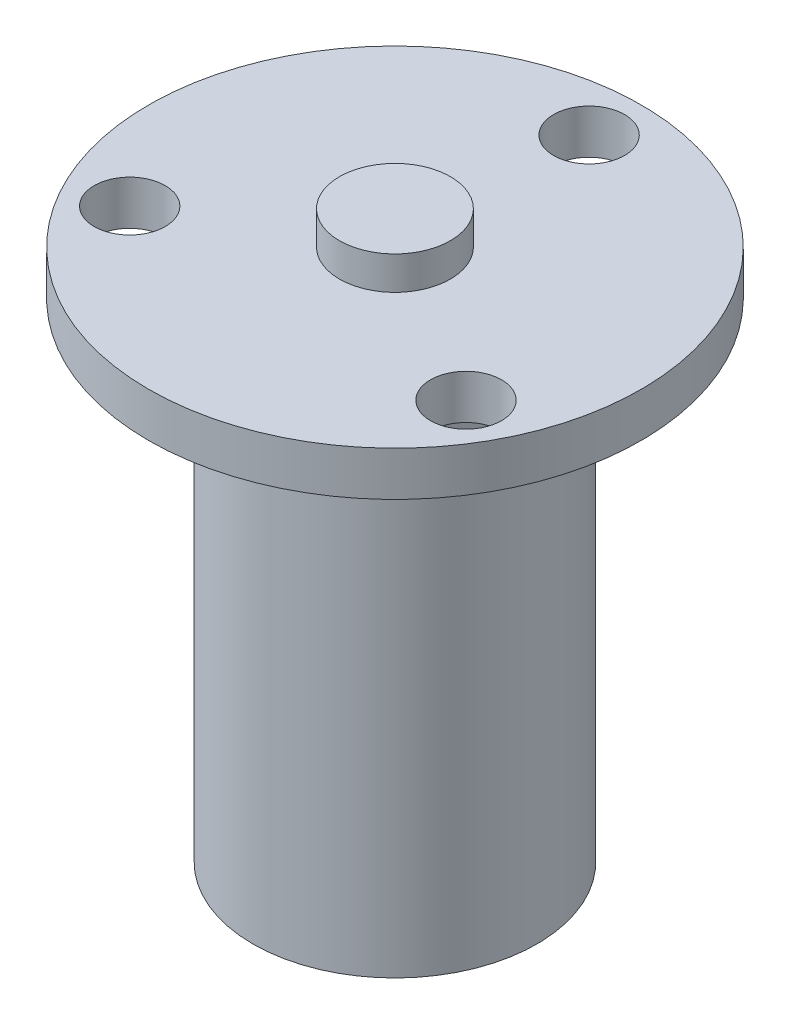
from build123d import *

# Parameters (mm, degrees)
SKETCH_1_R      = 6.4
EXTRUDE_1_DEPTH = 22
SKETCH_2_R      = 11.1
SKETCH_2_R_2    = 1.6
EXTRUDE_3_DEPTH = 2
SKETCH_3_R      = 2.5
EXTRUDE_4_DEPTH = 1.5


with BuildPart() as part:
    # 草图1 → 凸台-拉伸1 (new body)
    with BuildSketch(Plane(origin=(0, 0, 0), x_dir=(1, 0, 0), z_dir=(0, 1, 0))):
        with Locations(Location((0, 0, 0), (0, 0, 270))):
            Circle(SKETCH_1_R)
    extrude(amount=EXTRUDE_1_DEPTH)

    # 草图2 → 凸台-拉伸3 (add)
    with BuildSketch(Plane(origin=(0, 22, 0), x_dir=(1, 0, 0), z_dir=(0, 1, 0))):
        with Locations(Location((0, 0, 0), (0, 0, 270))):
            Circle(SKETCH_2_R)
        with Locations(Location((0, 8.75, 0), (0, 0, 270))):
            Circle(SKETCH_2_R_2, mode=Mode.SUBTRACT)
        with Locations(Location((7.577722283, -4.375, 0), (0, 0, 270))):
            Circle(SKETCH_2_R_2, mode=Mode.SUBTRACT)
        with Locations(Location((-7.577722283, -4.375, 0), (0, 0, 270))):
            Circle(SKETCH_2_R_2, mode=Mode.SUBTRACT)
    extrude(amount=EXTRUDE_3_DEPTH)

    # 草图3 → 凸台-拉伸4 (add)
    with BuildSketch(Plane(origin=(0, 24, 0), x_dir=(1, 0, 0), z_dir=(0, 1, 0))):
        with Locations(Location((0, 0, 0), (0, 0, 270))):
            Circle(SKETCH_3_R)
    extrude(amount=EXTRUDE_4_DEPTH)


solid = part.part
